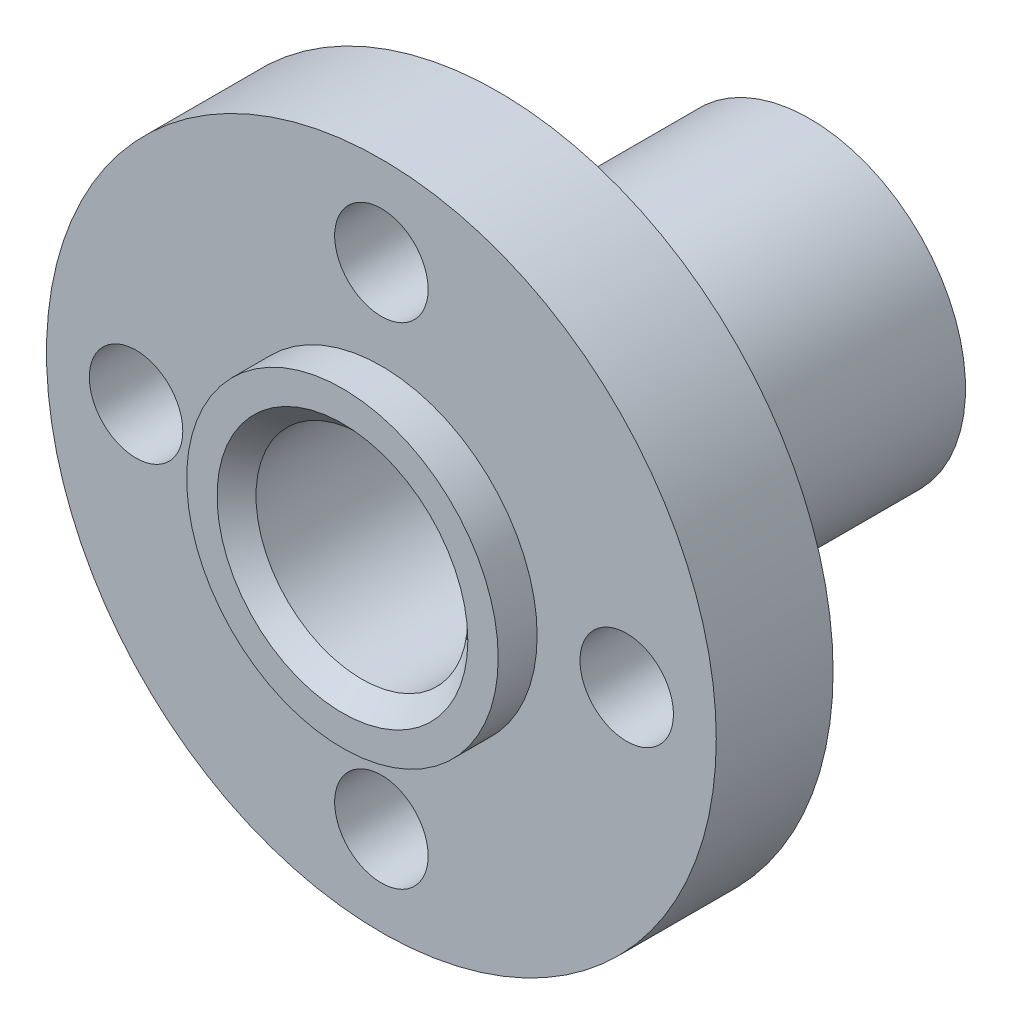
from build123d import *

# Parameters (mm, degrees)
SKETCH3_R                   = 10.75
BOSS_EXTRUDE1_DEPTH         = 3.75
SKETCH4_R                   = 5
BOSS_EXTRUDE2_DEPTH         = 10
BOSS_EXTRUDE3_START         = 1.25
SKETCH5_R                   = 5
BOSS_EXTRUDE3_DEPTH         = 1.25
M8_TAPPED_HOLE1_D           = 6.8
M8_TAPPED_HOLE1_DEPTH       = 15
M8_TAPPED_HOLE1_CSINK_D     = 8.05
M8_TAPPED_HOLE1_CSINK_ANGLE = 90
M8_TAPPED_HOLE1_TIP         = 2.042926105
SKETCH9_R                   = 1.5
CUT_EXTRUDE1_DEPTH          = 3.75


with BuildPart() as part:
    # Sketch3 → Boss-Extrude1 (new body)
    with BuildSketch(Plane.XY):
        Circle(SKETCH3_R)
    extrude(amount=-BOSS_EXTRUDE1_DEPTH)

    # Sketch4 → Boss-Extrude2 (add)
    with BuildSketch(Plane(origin=(0, 0, -3.75), x_dir=(-1, 0, 0), z_dir=(0, 0, -1))):
        Circle(SKETCH4_R)
    extrude(amount=BOSS_EXTRUDE2_DEPTH)

    # Sketch5 → Boss-Extrude3 (add)
    with BuildSketch(Plane.XY.offset(BOSS_EXTRUDE3_START)):
        with Locations(Location((0, 0, 0), (0, 0, 180))):
            Circle(SKETCH5_R)
    extrude(amount=-BOSS_EXTRUDE3_DEPTH)

    # M8 Tapped Hole1
    with Locations(Plane.XY.offset(1.25)):
        with Locations((0, 0)):
            CounterSinkHole(M8_TAPPED_HOLE1_D / 2, M8_TAPPED_HOLE1_CSINK_D / 2, depth=M8_TAPPED_HOLE1_DEPTH, counter_sink_angle=M8_TAPPED_HOLE1_CSINK_ANGLE)
            with Locations((0, 0, -(M8_TAPPED_HOLE1_DEPTH + M8_TAPPED_HOLE1_TIP / 2))):  # 118° drill point
                Cone(0, M8_TAPPED_HOLE1_D / 2, M8_TAPPED_HOLE1_TIP, mode=Mode.SUBTRACT)

    # Sketch9 → Cut-Extrude1 (cut)
    with BuildSketch(Plane.XY):
        with Locations((-7.875, 0)):
            Circle(SKETCH9_R)
        with Locations((0, 7.875)):
            Circle(SKETCH9_R)
        with Locations((7.875, 0)):
            Circle(SKETCH9_R)
        with Locations((0, -7.875)):
            Circle(SKETCH9_R)
    extrude(amount=-CUT_EXTRUDE1_DEPTH, mode=Mode.SUBTRACT)


solid = part.part
